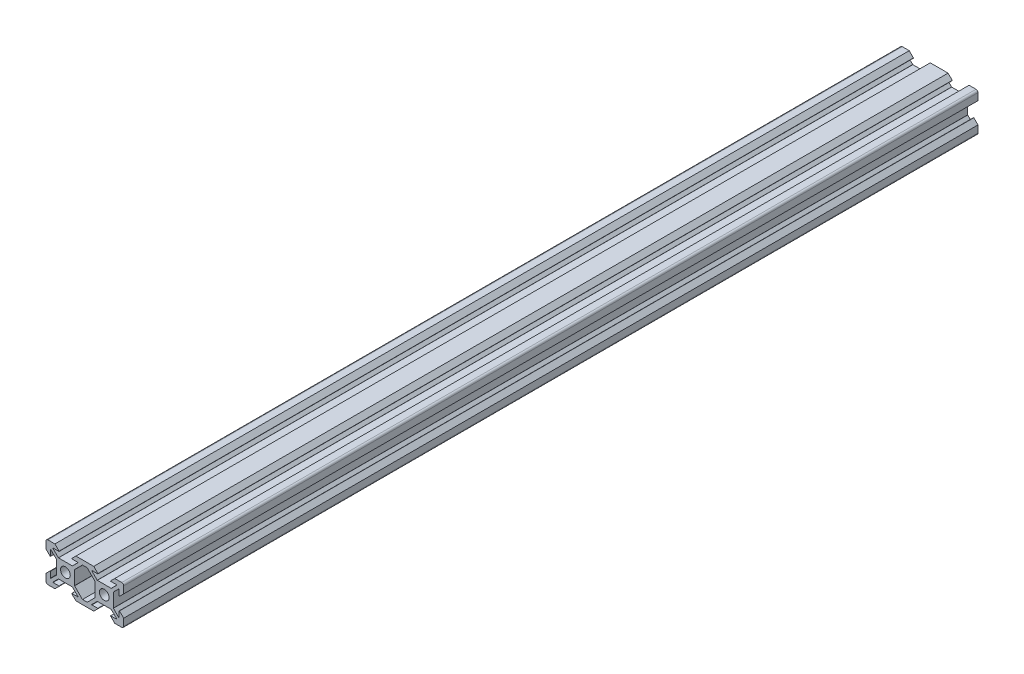
from build123d import *

# Parameters (mm, degrees)
CROQUIS4_R                 = 2.5
MIEMBRO_ESTRUCTURAL1_DEPTH = 440


with BuildPart() as part:
    # Croquis4 → Miembro estructural1 (new body)
    with BuildSketch(Plane.XY.offset(-220)):
        with BuildLine():
            Line((-19, -10), (-15.410285706, -10))
            Line((-15.410285706, -10), (-13.270710678, -7.860424973))
            ThreePointArc((-13.270710678, -7.860424973), (-13.249033403, -7.751445951), (-13.341421356, -7.689714294))
            Line((-13.341421356, -7.689714294), (-16.358578644, -7.689714294))
            ThreePointArc((-16.358578644, -7.689714294), (-16.450966597, -7.627982638), (-16.429289322, -7.519003616))
            Line((-16.429289322, -7.519003616), (-13.629289322, -4.719003616))
            ThreePointArc((-13.629289322, -4.719003616), (-13.596846987, -4.697326341), (-13.558578644, -4.689714294))
            Line((-13.558578644, -4.689714294), (-6.441421356, -4.689714294))
            ThreePointArc((-6.441421356, -4.689714294), (-6.403153013, -4.697326341), (-6.370710678, -4.719003616))
            Line((-6.370710678, -4.719003616), (-3.570710678, -7.519003616))
            ThreePointArc((-3.570710678, -7.519003616), (-3.549033403, -7.627982638), (-3.641421356, -7.689714294))
            Line((-3.641421356, -7.689714294), (-6.658578644, -7.689714294))
            ThreePointArc((-6.658578644, -7.689714294), (-6.750966597, -7.751445951), (-6.729289322, -7.860424973))
            Line((-6.729289322, -7.860424973), (-4.589714294, -10))
            Line((-4.589714294, -10), (4.589714294, -10))
            Line((4.589714294, -10), (6.729289322, -7.860424973))
            ThreePointArc((6.729289322, -7.860424973), (6.750966597, -7.751445951), (6.658578644, -7.689714294))
            Line((6.658578644, -7.689714294), (3.641421356, -7.689714294))
            ThreePointArc((3.641421356, -7.689714294), (3.549033403, -7.627982638), (3.570710678, -7.519003616))
            Line((3.570710678, -7.519003616), (6.370710678, -4.719003616))
            ThreePointArc((6.370710678, -4.719003616), (6.403153013, -4.697326341), (6.441421356, -4.689714294))
            Line((6.441421356, -4.689714294), (13.558578644, -4.689714294))
            ThreePointArc((13.558578644, -4.689714294), (13.596846987, -4.697326341), (13.629289322, -4.719003616))
            Line((13.629289322, -4.719003616), (16.429289322, -7.519003616))
            ThreePointArc((16.429289322, -7.519003616), (16.450966597, -7.627982638), (16.358578644, -7.689714294))
            Line((16.358578644, -7.689714294), (13.341421356, -7.689714294))
            ThreePointArc((13.341421356, -7.689714294), (13.249033403, -7.751445951), (13.270710678, -7.860424973))
            Line((13.270710678, -7.860424973), (15.410285706, -10))
            Line((15.410285706, -10), (19, -10))
            ThreePointArc((19, -10), (19.707106781, -9.707106781), (20, -9))
            Line((20, -9), (20, -5.410285706))
            Line((20, -5.410285706), (17.860424973, -3.270710678))
            ThreePointArc((17.860424973, -3.270710678), (17.751445951, -3.249033403), (17.689714294, -3.341421356))
            Line((17.689714294, -3.341421356), (17.689714294, -6.358578644))
            ThreePointArc((17.689714294, -6.358578644), (17.627982638, -6.450966597), (17.519003616, -6.429289322))
            Line((17.519003616, -6.429289322), (14.719003616, -3.629289322))
            ThreePointArc((14.719003616, -3.629289322), (14.697326341, -3.596846987), (14.689714294, -3.558578644))
            Line((14.689714294, -3.558578644), (14.689714294, 3.558578644))
            ThreePointArc((14.689714294, 3.558578644), (14.697326341, 3.596846987), (14.719003616, 3.629289322))
            Line((14.719003616, 3.629289322), (17.519003616, 6.429289322))
            ThreePointArc((17.519003616, 6.429289322), (17.627982638, 6.450966597), (17.689714294, 6.358578644))
            Line((17.689714294, 6.358578644), (17.689714294, 3.341421356))
            ThreePointArc((17.689714294, 3.341421356), (17.751445951, 3.249033403), (17.860424973, 3.270710678))
            Line((17.860424973, 3.270710678), (20, 5.410285706))
            Line((20, 5.410285706), (20, 9))
            ThreePointArc((20, 9), (19.707106781, 9.707106781), (19, 10))
            Line((19, 10), (15.410285706, 10))
            Line((15.410285706, 10), (13.270710678, 7.860424973))
            ThreePointArc((13.270710678, 7.860424973), (13.249033403, 7.751445951), (13.341421356, 7.689714294))
            Line((13.341421356, 7.689714294), (16.358578644, 7.689714294))
            ThreePointArc((16.358578644, 7.689714294), (16.450966597, 7.627982638), (16.429289322, 7.519003616))
            Line((16.429289322, 7.519003616), (13.629289322, 4.719003616))
            ThreePointArc((13.629289322, 4.719003616), (13.596846987, 4.697326341), (13.558578644, 4.689714294))
            Line((13.558578644, 4.689714294), (6.441421356, 4.689714294))
            ThreePointArc((6.441421356, 4.689714294), (6.403153013, 4.697326341), (6.370710678, 4.719003616))
            Line((6.370710678, 4.719003616), (3.570710678, 7.519003616))
            ThreePointArc((3.570710678, 7.519003616), (3.549033403, 7.627982638), (3.641421356, 7.689714294))
            Line((3.641421356, 7.689714294), (6.658578644, 7.689714294))
            ThreePointArc((6.658578644, 7.689714294), (6.750966597, 7.751445951), (6.729289322, 7.860424973))
            Line((6.729289322, 7.860424973), (4.589714294, 10))
            Line((4.589714294, 10), (-4.589714294, 10))
            Line((-4.589714294, 10), (-6.729289322, 7.860424973))
            ThreePointArc((-6.729289322, 7.860424973), (-6.750966597, 7.751445951), (-6.658578644, 7.689714294))
            Line((-6.658578644, 7.689714294), (-3.641421356, 7.689714294))
            ThreePointArc((-3.641421356, 7.689714294), (-3.549033403, 7.627982638), (-3.570710678, 7.519003616))
            Line((-3.570710678, 7.519003616), (-6.370710678, 4.719003616))
            ThreePointArc((-6.370710678, 4.719003616), (-6.403153013, 4.697326341), (-6.441421356, 4.689714294))
            Line((-6.441421356, 4.689714294), (-13.558578644, 4.689714294))
            ThreePointArc((-13.558578644, 4.689714294), (-13.596846987, 4.697326341), (-13.629289322, 4.719003616))
            Line((-13.629289322, 4.719003616), (-16.429289322, 7.519003616))
            ThreePointArc((-16.429289322, 7.519003616), (-16.450966597, 7.627982638), (-16.358578644, 7.689714294))
            Line((-16.358578644, 7.689714294), (-13.341421356, 7.689714294))
            ThreePointArc((-13.341421356, 7.689714294), (-13.249033403, 7.751445951), (-13.270710678, 7.860424973))
            Line((-13.270710678, 7.860424973), (-15.410285706, 10))
            Line((-15.410285706, 10), (-19, 10))
            ThreePointArc((-19, 10), (-19.707106781, 9.707106781), (-20, 9))
            Line((-20, 9), (-20, 5.410285706))
            Line((-20, 5.410285706), (-17.860424973, 3.270710678))
            ThreePointArc((-17.860424973, 3.270710678), (-17.751445951, 3.249033403), (-17.689714294, 3.341421356))
            Line((-17.689714294, 3.341421356), (-17.689714294, 6.358578644))
            ThreePointArc((-17.689714294, 6.358578644), (-17.627982638, 6.450966597), (-17.519003616, 6.429289322))
            Line((-17.519003616, 6.429289322), (-14.719003616, 3.629289322))
            ThreePointArc((-14.719003616, 3.629289322), (-14.697326341, 3.596846987), (-14.689714294, 3.558578644))
            Line((-14.689714294, 3.558578644), (-14.689714294, -3.558578644))
            ThreePointArc((-14.689714294, -3.558578644), (-14.697326341, -3.596846987), (-14.719003616, -3.629289322))
            Line((-14.719003616, -3.629289322), (-17.519003616, -6.429289322))
            ThreePointArc((-17.519003616, -6.429289322), (-17.627982638, -6.450966597), (-17.689714294, -6.358578644))
            Line((-17.689714294, -6.358578644), (-17.689714294, -3.341421356))
            ThreePointArc((-17.689714294, -3.341421356), (-17.751445951, -3.249033403), (-17.860424973, -3.270710678))
            Line((-17.860424973, -3.270710678), (-20, -5.410285706))
            Line((-20, -5.410285706), (-20, -9))
            ThreePointArc((-20, -9), (-19.707106781, -9.707106781), (-19, -10))
        make_face()
        with Locations((-10, 0)):
            Circle(CROQUIS4_R, mode=Mode.SUBTRACT)
        with Locations((10, 0)):
            Circle(CROQUIS4_R, mode=Mode.SUBTRACT)
        with BuildLine():
            Line((-2.480996384, 6.429289322), (-5.280996384, 3.629289322))
            ThreePointArc((-5.280996384, 3.629289322), (-5.302673659, 3.596846987), (-5.310285706, 3.558578644))
            Line((-5.310285706, 3.558578644), (-5.310285706, -3.558578644))
            ThreePointArc((-5.310285706, -3.558578644), (-5.302673659, -3.596846987), (-5.280996384, -3.629289322))
            Line((-5.280996384, -3.629289322), (-2.480996384, -6.429289322))
            Line((-2.480996384, -6.429289322), (-1.220571411, -7.689714294))
            Line((-1.220571411, -7.689714294), (1.220571411, -7.689714294))
            Line((1.220571411, -7.689714294), (2.480996384, -6.429289322))
            Line((2.480996384, -6.429289322), (5.280996384, -3.629289322))
            ThreePointArc((5.280996384, -3.629289322), (5.302673659, -3.596846987), (5.310285706, -3.558578644))
            Line((5.310285706, -3.558578644), (5.310285706, 3.558578644))
            ThreePointArc((5.310285706, 3.558578644), (5.302673659, 3.596846987), (5.280996384, 3.629289322))
            Line((5.280996384, 3.629289322), (2.480996384, 6.429289322))
            Line((2.480996384, 6.429289322), (1.220571411, 7.689714294))
            Line((1.220571411, 7.689714294), (-1.220571411, 7.689714294))
            Line((-1.220571411, 7.689714294), (-2.480996384, 6.429289322))
        make_face(mode=Mode.SUBTRACT)
    extrude(amount=MIEMBRO_ESTRUCTURAL1_DEPTH)


solid = part.part
